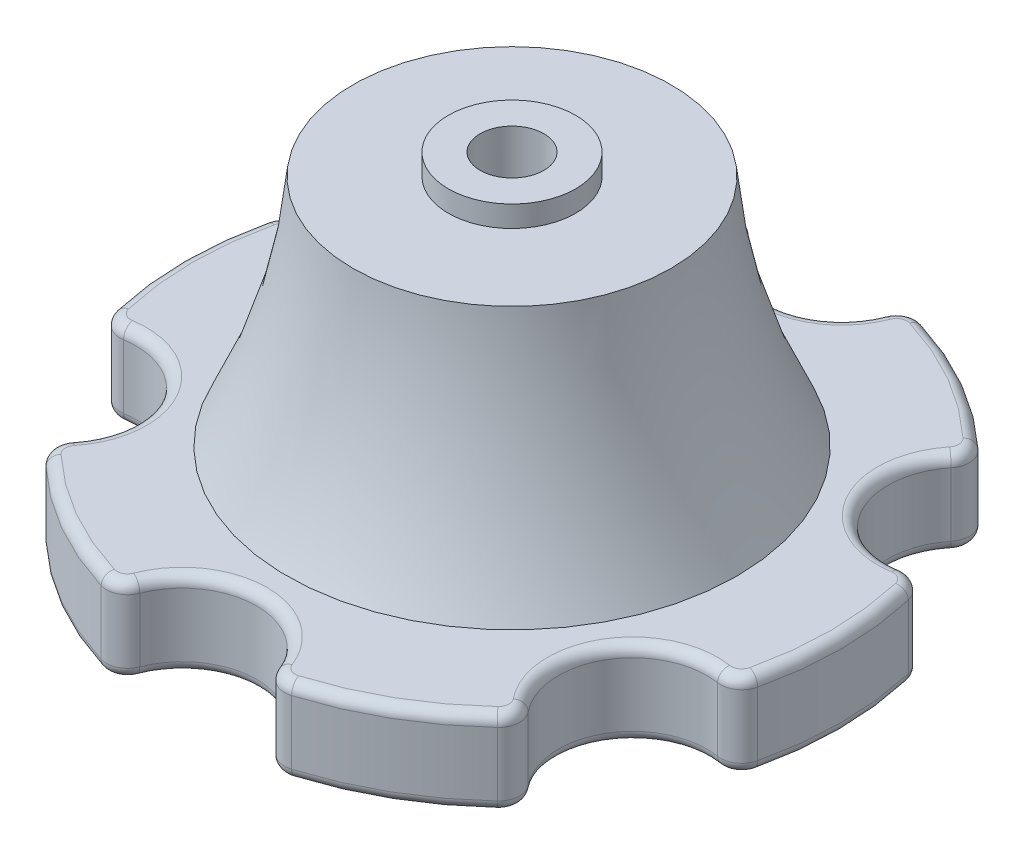
from build123d import *

# Parameters (mm, degrees)
EXTRUDE_1_DEPTH     = 15
SKETCH_3_R          = 1.5
CUT_EXTRUDE_1_DEPTH = 15
SKETCH_4_R          = 3
CUT_EXTRUDE_2_DEPTH = 6
FILLET_1_R          = 1
FILLET_2_R          = 0.5
SKETCH_5_R          = 3
SKETCH_5_R_2        = 1.5
EXTRUDE_2_DEPTH     = 1


with BuildPart() as part:
    # Эскиз1 → Бобышка-Вытянуть1 (new body)
    with BuildSketch(Plane(origin=(0, 0, 0), x_dir=(1, 0, 0), z_dir=(0, 1, 0))):
        with BuildLine():
            ThreePointArc((-3.477707616, 15.135602061), (0, 12.03), (3.477707616, 15.135602061))
            ThreePointArc((3.477707616, 15.135602061), (7.765, 13.449374521), (11.368962078, 10.579584173))
            ThreePointArc((11.368962078, 10.579584173), (10.418285608, 6.015), (14.846669694, 4.556017888))
            ThreePointArc((14.846669694, 4.556017888), (15.53, 0), (14.846669694, -4.556017888))
            ThreePointArc((14.846669694, -4.556017888), (10.418285608, -6.015), (11.368962078, -10.579584173))
            ThreePointArc((11.368962078, -10.579584173), (7.765, -13.449374521), (3.477707616, -15.135602061))
            ThreePointArc((3.477707616, -15.135602061), (0, -12.03), (-3.477707616, -15.135602061))
            ThreePointArc((-3.477707616, -15.135602061), (-7.765, -13.449374521), (-11.368962078, -10.579584173))
            ThreePointArc((-11.368962078, -10.579584173), (-10.418285608, -6.015), (-14.846669694, -4.556017888))
            ThreePointArc((-14.846669694, -4.556017888), (-15.53, 0), (-14.846669694, 4.556017888))
            ThreePointArc((-14.846669694, 4.556017888), (-10.418285608, 6.015), (-11.368962078, 10.579584173))
            ThreePointArc((-11.368962078, 10.579584173), (-7.765, 13.449374521), (-3.477707616, 15.135602061))
        make_face()
    extrude(amount=EXTRUDE_1_DEPTH)

    # Эскиз2 → Вырез-Повернуть1 (revolve, cut)
    with BuildSketch(Plane.XY, mode=Mode.PRIVATE) as cut_revolve_1_sk:
        with BuildLine():
            Line((-15.6, 31), (-15.6, 4))
            Line((-15.6, 4), (-10.6, 4))
            ThreePointArc((-10.6, 4), (-7.390856649, 17.5), (-10.6, 31))
            Line((-10.6, 31), (-15.6, 31))
        make_face()
    revolve(cut_revolve_1_sk.sketch.rotate(Axis((0, -1000, 0), (0, 1, 0)), 180), axis=Axis((0, -1000, 0), (0, 1, 0)), mode=Mode.SUBTRACT)

    # Эскиз3 → Вырез-Вытянуть1 (cut)
    with BuildSketch(Plane.XZ):
        with Locations(Location((0, 0, 0), (0, 0, 270))):
            Circle(SKETCH_3_R)
    extrude(amount=-CUT_EXTRUDE_1_DEPTH, mode=Mode.SUBTRACT)

    # Эскиз4 → Вырез-Вытянуть2 (cut)
    with BuildSketch(Plane.XZ):
        with Locations(Location((0, 0, 0), (0, 0, 270))):
            Circle(SKETCH_4_R)
    extrude(amount=-CUT_EXTRUDE_2_DEPTH, mode=Mode.SUBTRACT)

    # Скругление1
    fillet_1_edges = [part.edges().sort_by_distance(p)[0] for p in [
        (-3.477707616, 2, -15.135602061),
        (3.477707616, 2, -15.135602061),
        (11.368962078, 2, -10.579584173),
        (14.846669694, 2, -4.556017888),
        (14.846669694, 2, 4.556017888),
        (11.368962078, 2, 10.579584173),
        (3.477707616, 2, 15.135602061),
        (-3.477707616, 2, 15.135602061),
        (-11.368962078, 2, 10.579584173),
        (-14.846669694, 2, 4.556017888),
        (-14.846669694, 2, -4.556017888),
        (-11.368962078, 2, -10.579584173),
    ]]
    fillet(fillet_1_edges, radius=FILLET_1_R)

    # Скругление2
    fillet_2_edges = [part.edges().sort_by_distance(p)[0] for p in [
        (10.945056155, 4, -10.659830131),
        (14.704211771, 4, -4.148781611),
        (14.704211771, 4, 4.148781611),
        (10.945056155, 4, 10.659830131),
        (3.759155616, 4, 14.808611742),
        (-3.759155616, 4, 14.808611742),
        (-10.945056155, 4, 10.659830131),
        (-7.765, 4, 13.449374521),
        (-7.765, 0, 13.449374521),
        (-7.765, 0, -13.449374521),
        (0, 0, -12.03),
        (7.765, 0, -13.449374521),
        (10.418285608, 0, -6.015),
        (15.53, 0, 0),
        (10.418285608, 0, 6.015),
        (7.765, 0, 13.449374521),
        (0, 0, 12.03),
        (-10.418285608, 0, 6.015),
        (-15.53, 0, 0),
        (-10.418285608, 0, -6.015),
        (-14.704211771, 0, 4.148781611),
        (-14.704211771, 0, -4.148781611),
        (-10.945056155, 0, -10.659830131),
        (3.759155616, 0, -14.808611742),
        (-3.759155616, 0, -14.808611742),
        (10.945056155, 0, -10.659830131),
        (14.704211771, 0, -4.148781611),
        (14.704211771, 0, 4.148781611),
        (10.945056155, 0, 10.659830131),
        (3.759155616, 0, 14.808611742),
        (-3.759155616, 0, 14.808611742),
        (-10.945056155, 0, 10.659830131),
        (-10.418285608, 4, 6.015),
        (-7.765, 4, -13.449374521),
        (-10.418285608, 4, -6.015),
        (-15.53, 4, 0),
        (0, 4, 12.03),
        (7.765, 4, 13.449374521),
        (10.418285608, 4, 6.015),
        (15.53, 4, 0),
        (10.418285608, 4, -6.015),
        (7.765, 4, -13.449374521),
        (0, 4, -12.03),
        (-14.704211771, 4, 4.148781611),
        (-14.704211771, 4, -4.148781611),
        (-10.945056155, 4, -10.659830131),
        (3.759155616, 4, -14.808611742),
        (-3.759155616, 4, -14.808611742),
    ]]
    fillet(fillet_2_edges, radius=FILLET_2_R)

    # Эскиз5 → Бобышка-Вытянуть2 (add)
    with BuildSketch(Plane(origin=(0, 15, 0), x_dir=(1, 0, 0), z_dir=(0, 1, 0))):
        with Locations(Location((0, 0, 0), (0, 0, 90))):
            Circle(SKETCH_5_R)
        with Locations(Location((0, 0, 0), (0, 0, 90))):
            Circle(SKETCH_5_R_2, mode=Mode.SUBTRACT)
    extrude(amount=EXTRUDE_2_DEPTH)


solid = part.part
